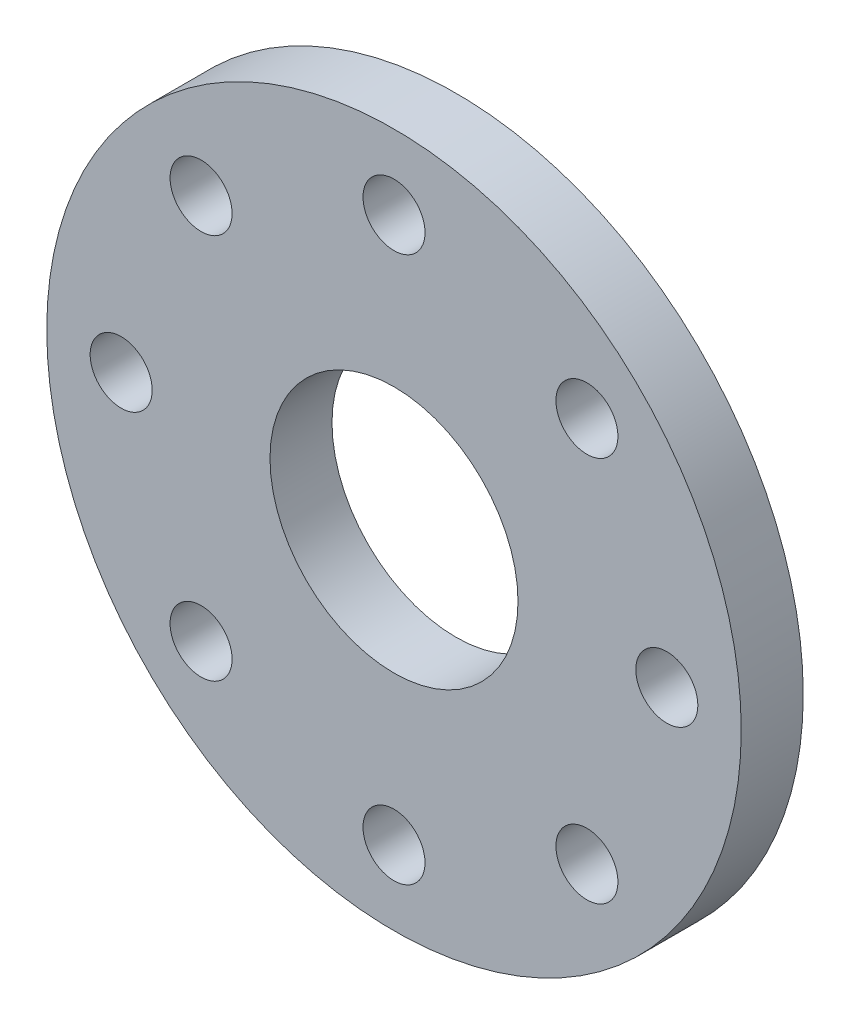
from build123d import *

# Parameters (mm, degrees)
ESBO_O1_R                = 14
ESBO_O1_R_2              = 5
ESBO_O1_R_3              = 1.25
RESSALTO_EXTRUS_O1_DEPTH = 2.5


with BuildPart() as part:
    # Esboço1 → Ressalto-extrusão1 (new body)
    with BuildSketch(Plane.XY):
        Circle(ESBO_O1_R)
        Circle(ESBO_O1_R_2, mode=Mode.SUBTRACT)
        with Locations((0, 11)):
            Circle(ESBO_O1_R_3, mode=Mode.SUBTRACT)
        with Locations((7.778174593, 7.778174593)):
            Circle(ESBO_O1_R_3, mode=Mode.SUBTRACT)
        with Locations((11, 0)):
            Circle(ESBO_O1_R_3, mode=Mode.SUBTRACT)
        with Locations((7.778174593, -7.778174593)):
            Circle(ESBO_O1_R_3, mode=Mode.SUBTRACT)
        with Locations((0, -11)):
            Circle(ESBO_O1_R_3, mode=Mode.SUBTRACT)
        with Locations((-7.778174593, -7.778174593)):
            Circle(ESBO_O1_R_3, mode=Mode.SUBTRACT)
        with Locations((-11, 0)):
            Circle(ESBO_O1_R_3, mode=Mode.SUBTRACT)
        with Locations((-7.778174593, 7.778174593)):
            Circle(ESBO_O1_R_3, mode=Mode.SUBTRACT)
    extrude(amount=RESSALTO_EXTRUS_O1_DEPTH)


solid = part.part
